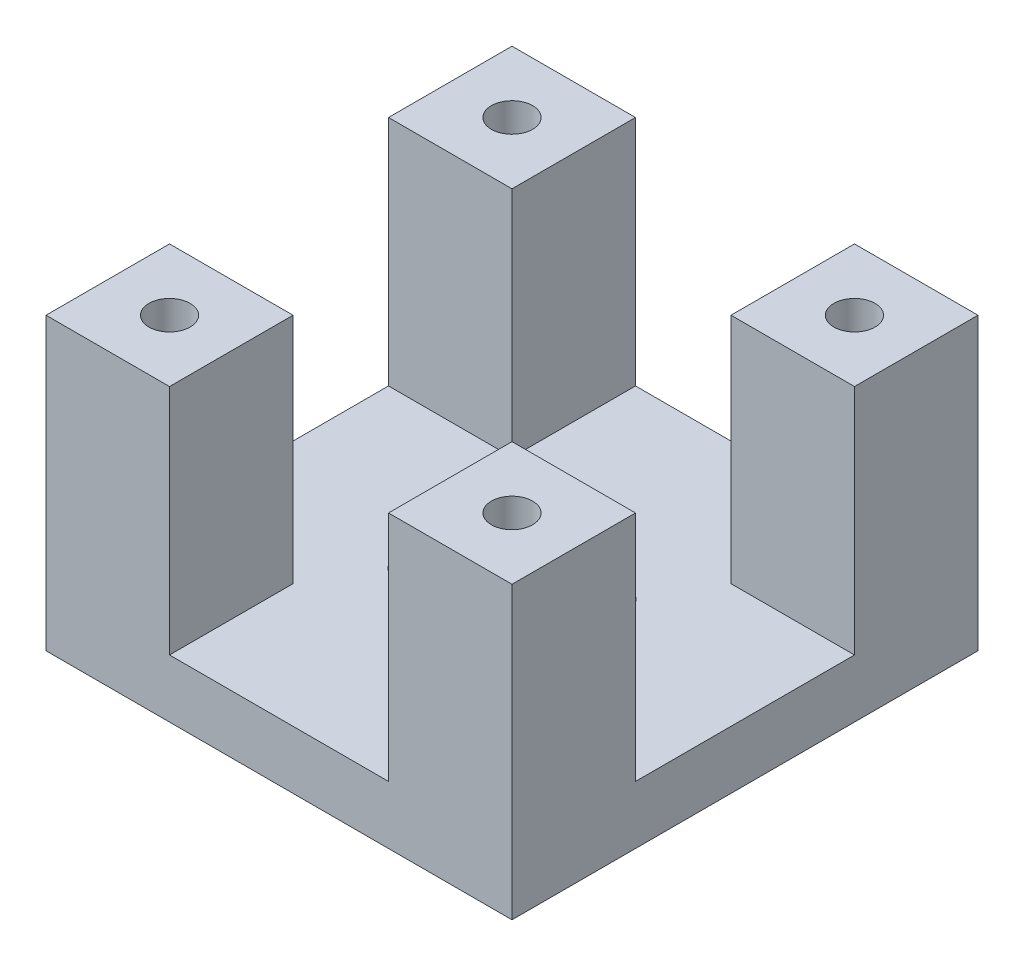
from build123d import *

# Parameters (mm, degrees)
SKETCH1_W                               = 96.210678118
SKETCH1_H                               = 96.210678118
SKETCH1_R                               = 11
SKETCH1_R_2                             = 2
SKETCH1_R_3                             = 4.25
MAIN_BODY_DEPTH                         = 60
MAIN_MILL_CUT_DEPTH                     = 48
SKETCH2_R                               = 3.625
MOTOR_MOUNT_BOLT_HEAD_COUNTERSINK_DEPTH = 54


with BuildPart() as part:
    # Sketch1 → main body (new body)
    with BuildSketch(Plane(origin=(0, 0, 0), x_dir=(1, 0, 0), z_dir=(0, 1, 0))):
        Rectangle(SKETCH1_W, SKETCH1_H)
        with Locations(Location((0, 0, 0), (0, 0, 270))):
            Circle(SKETCH1_R, mode=Mode.SUBTRACT)
        with Locations(Location((0, 15, 0), (0, 0, 270))):
            Circle(SKETCH1_R_2, mode=Mode.SUBTRACT)
        with Locations(Location((35.355339059, 35.355339059, 0), (0, 0, 270))):
            Circle(SKETCH1_R_3, mode=Mode.SUBTRACT)
        with Locations(Location((12.990381057, 7.5, 0), (0, 0, 270))):
            Circle(SKETCH1_R_2, mode=Mode.SUBTRACT)
        with Locations(Location((12.990381057, -7.5, 0), (0, 0, 270))):
            Circle(SKETCH1_R_2, mode=Mode.SUBTRACT)
        with Locations(Location((0, -15, 0), (0, 0, 270))):
            Circle(SKETCH1_R_2, mode=Mode.SUBTRACT)
        with Locations(Location((-12.990381057, -7.5, 0), (0, 0, 270))):
            Circle(SKETCH1_R_2, mode=Mode.SUBTRACT)
        with Locations(Location((-12.990381057, 7.5, 0), (0, 0, 270))):
            Circle(SKETCH1_R_2, mode=Mode.SUBTRACT)
        with Locations(Location((35.355339059, -35.355339059, 0), (0, 0, 270))):
            Circle(SKETCH1_R_3, mode=Mode.SUBTRACT)
        with Locations(Location((-35.355339059, -35.355339059, 0), (0, 0, 270))):
            Circle(SKETCH1_R_3, mode=Mode.SUBTRACT)
        with Locations(Location((-35.355339059, 35.355339059, 0), (0, 0, 270))):
            Circle(SKETCH1_R_3, mode=Mode.SUBTRACT)
    extrude(amount=MAIN_BODY_DEPTH)

    # Sketch4 → main mill cut (cut)
    with BuildSketch(Plane(origin=(0, 60, 0), x_dir=(1, 0, 0), z_dir=(0, 1, 0))):
        Polygon((-22.605339059, 48.105339059), (22.605339059, 48.105339059), (22.605339059, 22.605339059), (48.105339059, 22.605339059), (48.105339059, -22.605339059), (22.605339059, -22.605339059), (22.605339059, -48.105339059), (-22.605339059, -48.105339059), (-22.605339059, -22.605339059), (-48.105339059, -22.605339059), (-48.105339059, 22.605339059), (-22.605339059, 22.605339059), align=None)
    extrude(amount=-MAIN_MILL_CUT_DEPTH, mode=Mode.SUBTRACT)

    # Sketch2 → motor mount bolt head countersink (cut)
    with BuildSketch(Plane(origin=(0, 60, 0), x_dir=(1, 0, 0), z_dir=(0, 1, 0))):
        with Locations(Location((12.990381057, 7.5, 0), (0, 0, 270))):
            Circle(SKETCH2_R)
        with Locations(Location((0, 15, 0), (0, 0, 270))):
            Circle(SKETCH2_R)
        with Locations(Location((12.990381057, -7.5, 0), (0, 0, 270))):
            Circle(SKETCH2_R)
        with Locations(Location((0, -15, 0), (0, 0, 270))):
            Circle(SKETCH2_R)
        with Locations(Location((-12.990381057, -7.5, 0), (0, 0, 270))):
            Circle(SKETCH2_R)
        with Locations(Location((-12.990381057, 7.5, 0), (0, 0, 270))):
            Circle(SKETCH2_R)
    extrude(amount=-MOTOR_MOUNT_BOLT_HEAD_COUNTERSINK_DEPTH, mode=Mode.SUBTRACT)


solid = part.part
